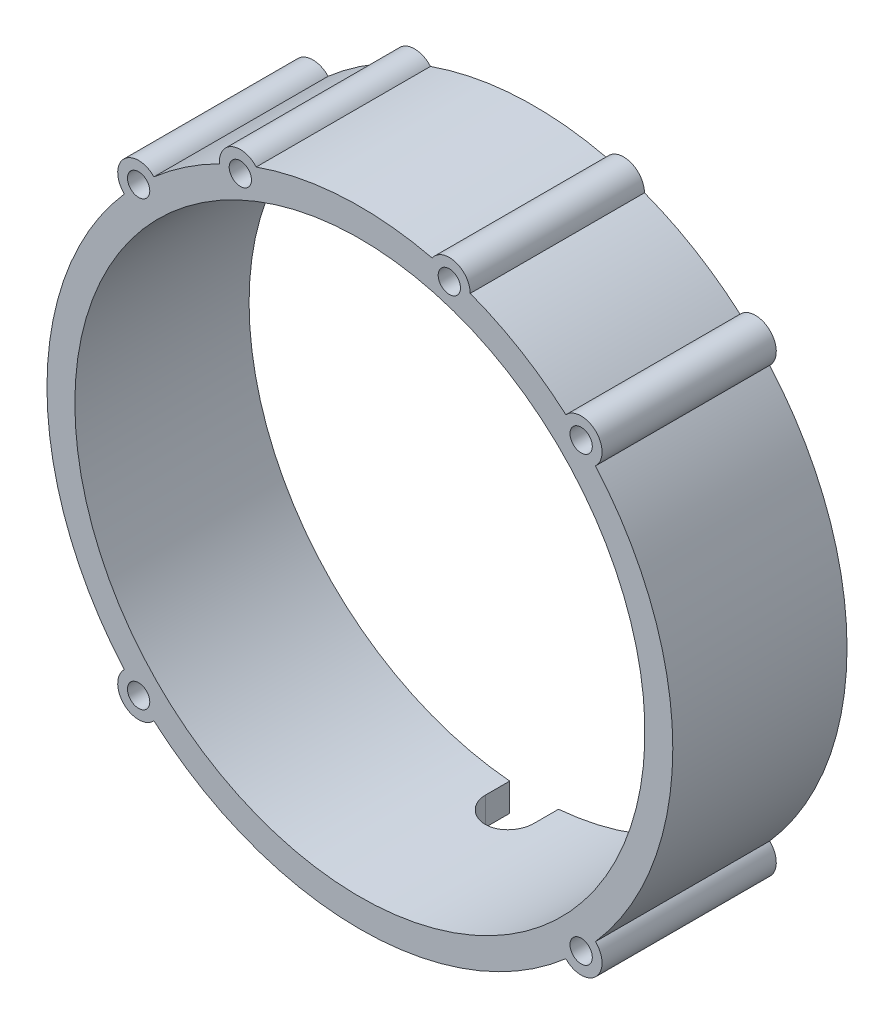
from build123d import *

# Parameters (mm, degrees)
SKETCH_1_R          = 46.9
SKETCH_1_R_2        = 1.6
EXTRUDE_1_DEPTH     = 25
SKETCH_2_R          = 3
EXTRUDE_2_DEPTH     = 25
SKETCH_3_R          = 1.6
CUT_EXTRUDE_1_DEPTH = 71.881732484
CUT_EXTRUDE_2_DEPTH = 71.881732484
CUT_EXTRUDE_3_DEPTH = 69.296196254


with BuildPart() as part:
    # 草图1 → 凸台-拉伸1 (new body)
    with BuildSketch(Plane.XY):
        Circle(SKETCH_1_R)
        with Locations((12.835117837, 41.981778787)):
            Circle(SKETCH_1_R_2, mode=Mode.SUBTRACT)
        with Locations((-17.153096541, 40.410163067)):
            Circle(SKETCH_1_R_2, mode=Mode.SUBTRACT)
        with BuildLine():
            ThreePointArc((-17.670567057, 36.885783981), (5.183019571, -40.570263841), (7.829749303, 40.143555222))
            ThreePointArc((7.829749303, 40.143555222), (-5.183019571, 40.570263841), (-17.670567057, 36.885783981))
        make_face(mode=Mode.SUBTRACT)
    extrude(amount=EXTRUDE_1_DEPTH)

    # 草图2 → 凸台-拉伸2 (add)
    with BuildSketch(Plane.XY.offset(25)):
        with Locations((-31.749094475, 31.749094475)):
            Circle(SKETCH_2_R)
        with Locations((31.749094475, 31.749094475)):
            Circle(SKETCH_2_R)
        with Locations((31.749094475, -31.749094475)):
            Circle(SKETCH_2_R)
        with Locations((-31.749094475, -31.749094475)):
            Circle(SKETCH_2_R)
    extrude(amount=-EXTRUDE_2_DEPTH)

    # 草图3 → 切除-拉伸1 (cut, through all)
    with BuildSketch(Plane.XY.offset(25)):
        with Locations((-31.749094475, 31.749094475)):
            Circle(SKETCH_3_R)
        with Locations((-31.749094475, -31.749094475)):
            Circle(SKETCH_3_R)
        with Locations((31.749094475, -31.749094475)):
            Circle(SKETCH_3_R)
        with Locations((31.749094475, 31.749094475)):
            Circle(SKETCH_3_R)
    extrude(amount=-CUT_EXTRUDE_1_DEPTH, mode=Mode.SUBTRACT)

    # 草图4 → 切除-拉伸2 (cut, through all)
    with BuildSketch(Plane.XY.offset(25)):
        with BuildLine():
            ThreePointArc((-20.139957039, 40.129691383), (-19.72949951, 41.947091088), (-18.325289842, 43.171677663))
            ThreePointArc((-18.325289842, 43.171677663), (-25.271051352, 39.509289586), (-31.508446668, 34.739427004))
            ThreePointArc((-31.508446668, 34.739427004), (-30.445394472, 34.451013479), (-29.558090066, 33.798362559))
            ThreePointArc((-29.558090066, 33.798362559), (-25.049858336, 37.262777638), (-20.139957039, 40.129691383))
        make_face()
        with BuildLine():
            ThreePointArc((-14.876494449, 42.363898698), (-7.545559902, 44.261433842), (0, 44.9))
            Line((0, 44.9), (0, 46.9))
            ThreePointArc((0, 46.9), (-9.350356079, 45.958468656), (-18.325289842, 43.171677663))
            ThreePointArc((-18.325289842, 43.171677663), (-16.468950059, 43.331112158), (-14.876494449, 42.363898698))
        make_face()
        with BuildLine():
            ThreePointArc((31.508446668, 34.739427004), (23.168662113, 40.777727939), (13.712233545, 44.850692873))
            ThreePointArc((13.712233545, 44.850692873), (15.23675449, 43.779594513), (15.834933275, 42.015055494))
            ThreePointArc((15.834933275, 42.015055494), (23.065345276, 38.522718586), (29.558090066, 33.798362559))
            ThreePointArc((29.558090066, 33.798362559), (30.445394472, 34.451013479), (31.508446668, 34.739427004))
        make_face()
        with BuildLine():
            Line((0, 46.9), (0, 44.9))
            ThreePointArc((0, 44.9), (5.218754509, 44.595679178), (10.366766227, 43.686841932))
            ThreePointArc((10.366766227, 43.686841932), (11.849397199, 44.81521395), (13.712233545, 44.850692873))
            ThreePointArc((13.712233545, 44.850692873), (6.932261689, 46.384843946), (0, 46.9))
        make_face()
        with BuildLine():
            ThreePointArc((34.739427004, 31.508446668), (34.451013479, 30.445394472), (33.798362559, 29.558090066))
            ThreePointArc((33.798362559, 29.558090066), (44.9, 0), (33.798362559, -29.558090066))
            ThreePointArc((33.798362559, -29.558090066), (34.451013479, -30.445394472), (34.739427004, -31.508446668))
            ThreePointArc((34.739427004, -31.508446668), (46.9, 0), (34.739427004, 31.508446668))
        make_face()
        with BuildLine():
            ThreePointArc((31.508446668, -34.739427004), (30.445394472, -34.451013479), (29.558090066, -33.798362559))
            ThreePointArc((29.558090066, -33.798362559), (0, -44.9), (-29.558090066, -33.798362559))
            ThreePointArc((-29.558090066, -33.798362559), (-30.445394472, -34.451013479), (-31.508446668, -34.739427004))
            ThreePointArc((-31.508446668, -34.739427004), (0, -46.9), (31.508446668, -34.739427004))
        make_face()
        with BuildLine():
            ThreePointArc((-33.798362559, 29.558090066), (-44.9, 0), (-33.798362559, -29.558090066))
            ThreePointArc((-33.798362559, -29.558090066), (-34.451013479, -30.445394472), (-34.739427004, -31.508446668))
            ThreePointArc((-34.739427004, -31.508446668), (-46.9, 0), (-34.739427004, 31.508446668))
            ThreePointArc((-34.739427004, 31.508446668), (-34.451013479, 30.445394472), (-33.798362559, 29.558090066))
        make_face()
    extrude(amount=-CUT_EXTRUDE_2_DEPTH, mode=Mode.SUBTRACT)

    # 草图6 → 切除-拉伸3 (cut, through all)
    with BuildSketch(Plane(origin=(0, 0, 0), x_dir=(1, 0, 0), z_dir=(0, 1, 0))):
        with BuildLine():
            Line((-3.5, -3.5), (-3.5, 0))
            Line((-3.5, 0), (3.5, 0))
            Line((3.5, 0), (3.5, -3.5))
            ThreePointArc((3.5, -3.5), (0, -7), (-3.5, -3.5))
        make_face()
    extrude(amount=-CUT_EXTRUDE_3_DEPTH, mode=Mode.SUBTRACT)


solid = part.part
